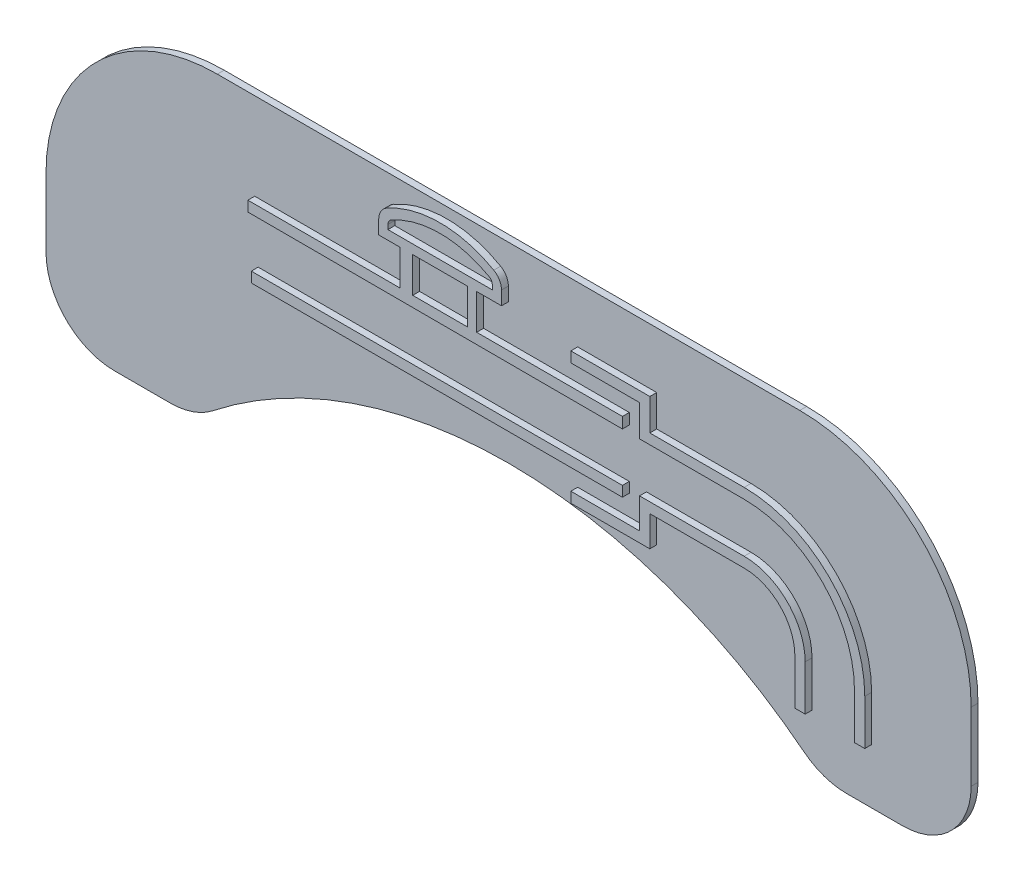
from build123d import *

# Parameters (mm, degrees)
EXTRUSION1_DEPTH = 0.2
ESQUISSE2_W      = 1.59785128
ESQUISSE2_H      = 1.03077013
ESQUISSE2_W_2    = 10.83121002
ESQUISSE2_H_2    = 0.3
EXTRUSION2_DEPTH = 0.2


with BuildPart() as part:
    # Esquisse1 → Extrusion1 (new body)
    with BuildSketch(Plane.XY):
        with BuildLine():
            Line((-27.5, -6.00142003), (-27.5, -8.00142003))
            ThreePointArc((-27.5, -8.00142003), (-26.914213562, -9.415633592), (-25.5, -10.00142003))
            Line((-25.5, -10.00142003), (-23.865139014, -10.00142003))
            ThreePointArc((-23.865139014, -10.00142003), (-23.210588236, -9.891278035), (-22.628130987, -9.572983309))
            ThreePointArc((-22.628130987, -9.572983309), (-14, -6.584637184), (-5.371869013, -9.572983309))
            ThreePointArc((-5.371869013, -9.572983309), (-4.789411764, -9.891278035), (-4.134860986, -10.00142003))
            Line((-4.134860986, -10.00142003), (-2.5, -10.00142003))
            ThreePointArc((-2.5, -10.00142003), (-1.085786438, -9.415633592), (-0.5, -8.00142003))
            Line((-0.5, -8.00142003), (-0.5, -6.00142003))
            ThreePointArc((-0.5, -6.00142003), (-1.964466094, -2.465886124), (-5.5, -1.00142003))
            Line((-5.5, -1.00142003), (-22.5, -1.00142003))
            ThreePointArc((-22.5, -1.00142003), (-26.035533906, -2.465886124), (-27.5, -6.00142003))
        make_face()
    extrude(amount=EXTRUSION1_DEPTH)

    # Esquisse2 → Extrusion2 (add)
    # profile 1 of 4: a face of its own
    with BuildSketch(Plane.XY.offset(0.2)):
        with BuildLine():
            Line((-14.730316635, -2.510657311), (-14.006042275, -2.510657311))
            Line((-14.006042275, -2.510657311), (-14.006042275, -2.111468697))
            ThreePointArc((-14.006042275, -2.111468697), (-14.066642884, -1.886467114), (-14.232049919, -1.722337108))
            ThreePointArc((-14.232049919, -1.722337108), (-15.798042275, -1.307063885), (-17.364034631, -1.722337108))
            ThreePointArc((-17.364034631, -1.722337108), (-17.529441665, -1.886467114), (-17.590042275, -2.111468697))
            Line((-17.590042275, -2.111468697), (-17.590042275, -2.510657311))
            Line((-17.590042275, -2.510657311), (-16.965767915, -2.510657311))
            Line((-16.965767915, -2.510657311), (-16.965767915, -3.541427441))
            Line((-16.965767915, -3.541427441), (-21.408442275, -3.541427441))
            Line((-21.408442275, -3.541427441), (-21.408442275, -3.841427441))
            Line((-21.408442275, -3.841427441), (-10.477242275, -3.859176516))
            Line((-10.477242275, -3.859176516), (-10.477242275, -3.541427441))
            Line((-10.477242275, -3.541427441), (-14.730316635, -3.541427441))
            Line((-14.730316635, -3.541427441), (-14.730316635, -2.510657311))
        make_face()
        with Locations((-15.798042275, -3.026042376)):
            Rectangle(ESQUISSE2_W, ESQUISSE2_H, mode=Mode.SUBTRACT)
        with BuildLine():
            Line((-17.321242275, -2.241857311), (-14.274842275, -2.241857311))
            Line((-14.274842275, -2.241857311), (-14.274842275, -2.111468697))
            ThreePointArc((-14.274842275, -2.111468697), (-14.299082519, -2.021468064), (-14.365245332, -1.955816061))
            ThreePointArc((-14.365245332, -1.955816061), (-15.798042275, -1.575863885), (-17.230839217, -1.955816061))
            ThreePointArc((-17.230839217, -1.955816061), (-17.297002031, -2.021468064), (-17.321242275, -2.111468697))
            Line((-17.321242275, -2.111468697), (-17.321242275, -2.241857311))
        make_face(mode=Mode.SUBTRACT)
    # profile 2 of 4: a face of its own
    with BuildSketch(Plane.XY.offset(0.2)):
        with Locations((-15.892837265, -5.434307441)):
            Rectangle(ESQUISSE2_W_2, ESQUISSE2_H_2)
    # profile 3 of 4: a face of its own
    with BuildSketch(Plane.XY.offset(0.2)):
        with BuildLine():
            Line((-11.983013473, -2.941427441), (-11.983013473, -2.637464752))
            Line((-11.983013473, -2.637464752), (-9.677242275, -2.637464752))
            Line((-9.677242275, -2.637464752), (-9.677242275, -3.559176516))
            Line((-9.677242275, -3.559176516), (-6.924787178, -3.559176516))
            ThreePointArc((-6.924787178, -3.559176516), (-4.435771308, -4.590160647), (-3.404787178, -7.079176516))
            Line((-3.404787178, -7.079176516), (-3.404787178, -8.399718672))
            Line((-3.404787178, -8.399718672), (-3.704787178, -8.399718672))
            Line((-3.704787178, -8.399718672), (-3.704787178, -7.079176516))
            ThreePointArc((-3.704787178, -7.079176516), (-4.647903343, -4.802292681), (-6.924787178, -3.859176516))
            Line((-6.924787178, -3.859176516), (-9.977242275, -3.859176516))
            Line((-9.977242275, -3.859176516), (-9.977242275, -2.941427441))
            Line((-9.977242275, -2.941427441), (-11.983013473, -2.941427441))
        make_face()
    # profile 4 of 4: a face of its own
    with BuildSketch(Plane.XY.offset(0.2)):
        with BuildLine():
            Line((-5.444787178, -7.079176516), (-5.444787178, -8.399718672))
            Line((-5.444787178, -8.399718672), (-5.144787178, -8.399718672))
            Line((-5.144787178, -8.399718672), (-5.144787178, -7.079176516))
            ThreePointArc((-5.144787178, -7.079176516), (-5.666137108, -5.820526446), (-6.924787178, -5.299176516))
            Line((-6.924787178, -5.299176516), (-9.977242275, -5.299176516))
            Line((-9.977242275, -5.299176516), (-9.977242275, -6.184307441))
            Line((-9.977242275, -6.184307441), (-11.983013473, -6.184307441))
            Line((-11.983013473, -6.184307441), (-11.983013473, -6.488270129))
            Line((-11.983013473, -6.488270129), (-9.677242275, -6.488270129))
            Line((-9.677242275, -6.488270129), (-9.677242275, -5.599176516))
            Line((-9.677242275, -5.599176516), (-6.924787178, -5.599176516))
            ThreePointArc((-6.924787178, -5.599176516), (-5.878269142, -6.03265848), (-5.444787178, -7.079176516))
        make_face()
    extrude(amount=EXTRUSION2_DEPTH)


solid = part.part
